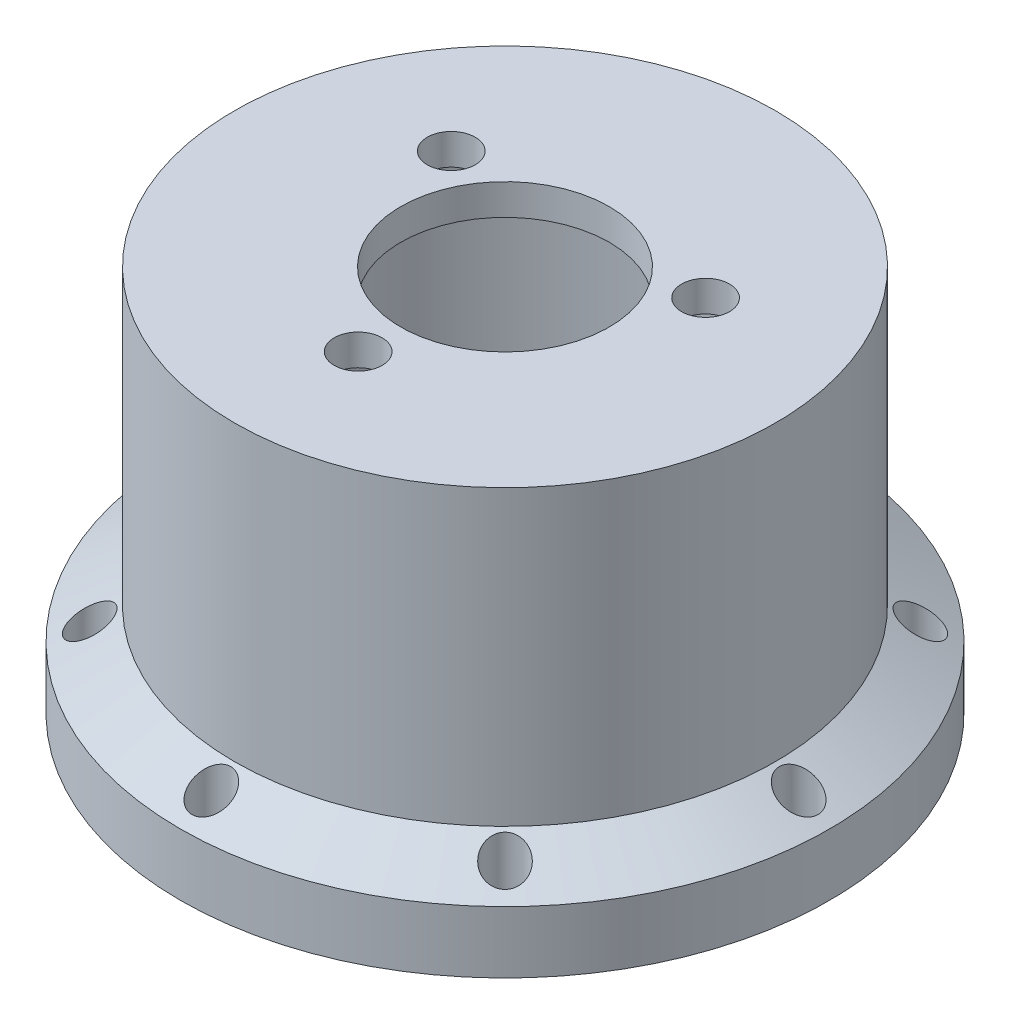
from build123d import *

# Parameters (mm, degrees)
SKETCH_2_R               = 1.25
CUT_EXTRUDE_1_DEPTH      = 8
PATTERN_CIRCULAR_1_COUNT = 8
SKETCH_3_R               = 1.55
CUT_EXTRUDE_2_DEPTH      = 41.137264585


with BuildPart() as part:
    # 草图1 → 旋转1 (revolve)
    with BuildSketch(Plane.XY, mode=Mode.PRIVATE) as revolve_1_sk:
        Polygon((-16, 0), (-17, 0), (-17, 2), (-21, 2), (-21, 6), (-17.5, 8.020725942), (-17.5, 27), (-6.75, 27), (-6.75, 25), (-16, 25), align=None)
    revolve(revolve_1_sk.sketch.rotate(Axis((0, 0, 0), (0, 1, 0)), 270), axis=Axis((0, 0, 0), (0, 1, 0)))

    # 草图2 → 切除-拉伸1 (cut)
    with BuildSketch(Plane.XZ.offset(-2)):
        with Locations(Location((0, -19, 0), (0, 0, 270))):
            Circle(SKETCH_2_R)
    cut_extrude_1 = extrude(amount=-CUT_EXTRUDE_1_DEPTH, mode=Mode.SUBTRACT)

    # 阵列(圆周)1: 切除-拉伸1 ×8 about axis
    pattern_circular_1_axis = Axis((0, 0, 0), (0, 1, 0))
    for i in range(1, PATTERN_CIRCULAR_1_COUNT):
        add(cut_extrude_1.rotate(pattern_circular_1_axis, i * 360 / PATTERN_CIRCULAR_1_COUNT), mode=Mode.SUBTRACT)

    # 草图3 → 切除-拉伸2 (cut, through all)
    with BuildSketch(Plane(origin=(0, 27, 0), x_dir=(1, 0, 0), z_dir=(0, 1, 0))):
        with Locations(Location((0, -9.5, 0), (0, 0, 270))):
            Circle(SKETCH_3_R)
        with Locations(Location((-8.227241336, 4.75, 0), (0, 0, 270))):
            Circle(SKETCH_3_R)
        with Locations(Location((8.227241336, 4.75, 0), (0, 0, 270))):
            Circle(SKETCH_3_R)
    extrude(amount=-CUT_EXTRUDE_2_DEPTH, mode=Mode.SUBTRACT)


solid = part.part
